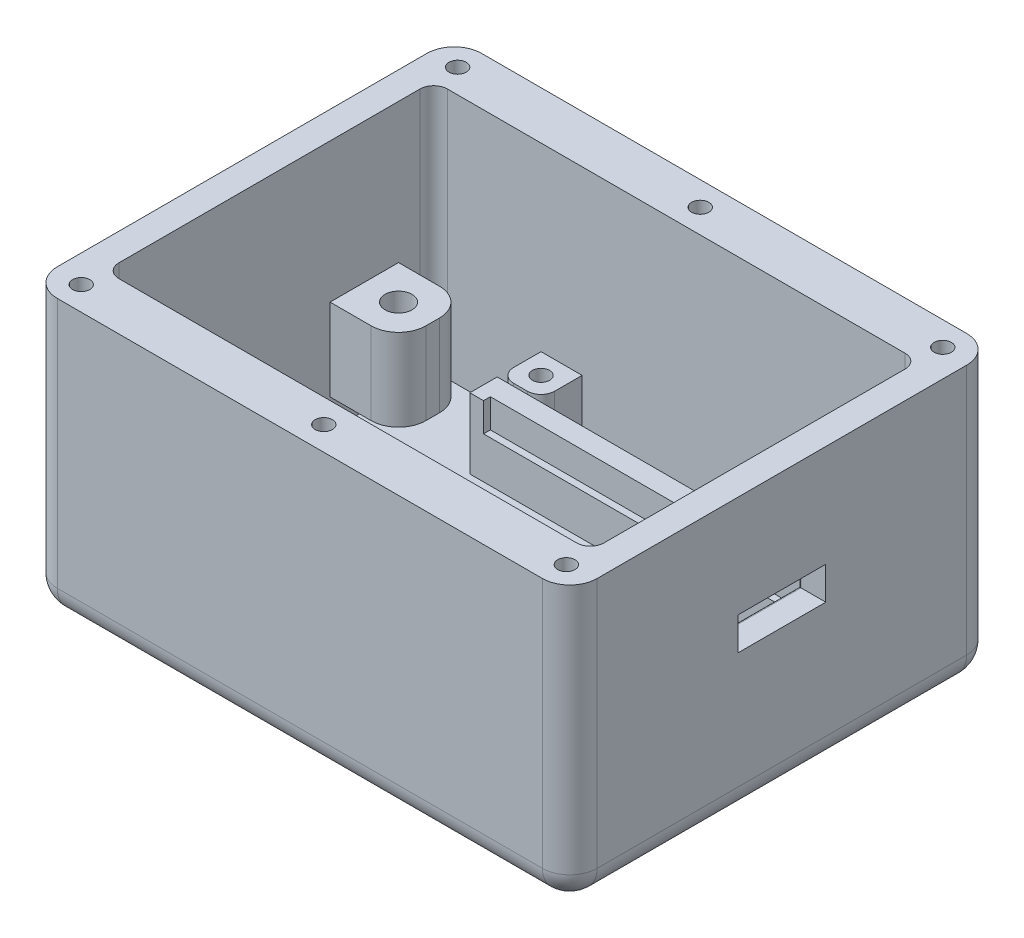
from build123d import *

# Parameters (mm, degrees)
SKETCH1_W                      = 50.0888
SKETCH1_H                      = 39.37
SKETCH1_W_2                    = 45.0088
SKETCH1_H_2                    = 30.48
BOSS_EXTRUDE1_DEPTH            = 23.2918
SKETCH2_W                      = 50.0888
SKETCH2_H                      = 39.37
BOSS_EXTRUDE2_DEPTH            = 2.54
SKETCH3_W                      = 32.512
SKETCH3_H                      = 2.54
BOSS_EXTRUDE3_DEPTH            = 6.5278
F_1_6_1_6_DIAMETER_HOLE1_D     = 1.6
F_1_6_1_6_DIAMETER_HOLE1_DEPTH = 5.08
FILLET1_R                      = 2.54
SKETCH12_W                     = 6.35
SKETCH12_H                     = 7.62
BOSS_EXTRUDE5_DEPTH            = 6.35
F_2_5_2_5_DIAMETER_HOLE2_D     = 2.5
F_2_5_2_5_DIAMETER_HOLE2_DEPTH = 7.62
FILLET2_R                      = 2.54
SKETCH17_W                     = 0.635
SKETCH17_H                     = 2.667
CUT_EXTRUDE3_DEPTH             = 31.242
SKETCH18_W                     = 0.635
SKETCH18_H                     = 2.667
CUT_EXTRUDE5_DEPTH             = 31.242
SKETCH15_W                     = 3.81
SKETCH15_H                     = 3.81
BOSS_EXTRUDE6_DEPTH            = 6.5278
FILLET3_R                      = 1.27
F_1_6_1_6_DIAMETER_HOLE2_D     = 1.6
F_1_6_1_6_DIAMETER_HOLE2_DEPTH = 5.08
CUT_EXTRUDE6_REACH             = 63.109
SKETCH23_W                     = 8.128
SKETCH23_H                     = 3.048
FILLET4_R                      = 0.254
FILLET5_R                      = 1.27


with BuildPart() as part:
    # Sketch1 → Boss-Extrude1 (new body)
    with BuildSketch(Plane(origin=(0, 0, 0), x_dir=(1, 0, 0), z_dir=(0, 1, 0))):
        with Locations((-15.50978333, -6.447590566)):
            Rectangle(SKETCH1_W, SKETCH1_H)
        with Locations((-15.50978333, -6.447590566)):
            Rectangle(SKETCH1_W_2, SKETCH1_H_2, mode=Mode.SUBTRACT)
    extrude(amount=BOSS_EXTRUDE1_DEPTH)

    # Sketch2 → Boss-Extrude2 (add)
    with BuildSketch(Plane.XZ):
        with Locations((-15.50978333, 6.447590566)):
            Rectangle(SKETCH2_W, SKETCH2_H)
    extrude(amount=BOSS_EXTRUDE2_DEPTH)

    # Sketch3 → Boss-Extrude3 (add)
    with BuildSketch(Plane(origin=(0, 0, 0), x_dir=(1, 0, 0), z_dir=(0, 1, 0))):
        with Locations((-11.80138333, 3.458409434)):
            Rectangle(SKETCH3_W, SKETCH3_H)
        with Locations((-11.80138333, -16.353590566)):
            Rectangle(SKETCH3_W, SKETCH3_H)
    extrude(amount=BOSS_EXTRUDE3_DEPTH)

    # Ø1.6 (1.6) Diameter Hole1
    with Locations(Plane(origin=(0, 23.2918, 0), x_dir=(1, 0, 0), z_dir=(0, 1, 0))):
        with Locations((-38.01418333, -23.910090566), (6.99461667, -23.910090566), (6.99461667, 11.014909434), (-38.01418333, 11.014909434), (-15.50978333, 11.014909434), (-15.50978333, -23.910090566)):
            Hole(F_1_6_1_6_DIAMETER_HOLE1_D / 2, depth=F_1_6_1_6_DIAMETER_HOLE1_DEPTH)

    # Fillet1
    fillet1_edges = [part.edges().sort_by_distance(p)[0] for p in [
        (-40.55418333, -2.54, 6.447590566),
        (-15.50978333, -2.54, -13.237409434),
        (9.53461667, -2.54, 6.447590566),
        (-15.50978333, -2.54, 26.132590566),
        (-40.55418333, 10.3759, -13.237409434),
        (9.53461667, 10.3759, -13.237409434),
        (9.53461667, 10.3759, 26.132590566),
        (-40.55418333, 10.3759, 26.132590566),
    ]]
    fillet(fillet1_edges, radius=FILLET1_R)

    # Sketch12 → Boss-Extrude5 (add)
    with BuildSketch(Plane(origin=(-38.01418333, 0, 0), x_dir=(0, 0, -1), z_dir=(1, 0, 0))):
        with Locations((-15.248690566, 6.5278)):
            Rectangle(SKETCH12_W, SKETCH12_H)
        with Locations((2.353509434, 6.5278)):
            Rectangle(SKETCH12_W, SKETCH12_H)
    extrude(amount=BOSS_EXTRUDE5_DEPTH)

    # Ø2.5 (2.5) Diameter Hole2
    with Locations(Plane(origin=(0, 10.3378, 0), x_dir=(1, 0, 0), z_dir=(0, 1, 0))):
        with Locations((-34.83918333, -15.248690566), (-34.83918333, 2.353509434)):
            Hole(F_2_5_2_5_DIAMETER_HOLE2_D / 2, depth=F_2_5_2_5_DIAMETER_HOLE2_DEPTH)

    # Fillet2
    fillet2_edges = [part.edges().sort_by_distance(p)[0] for p in [
        (-31.66418333, 6.5278, 18.423690566),
        (-31.66418333, 6.5278, 12.073690566),
        (-31.66418333, 6.5278, 0.821490566),
        (-31.66418333, 6.5278, -5.528509434),
    ]]
    fillet(fillet2_edges, radius=FILLET2_R)

    # Sketch17 → Cut-Extrude3 (cut)
    with BuildSketch(Plane(origin=(4.45461667, 0, 0), x_dir=(0, 0, -1), z_dir=(1, 0, 0))):
        with Locations((2.505909434, 5.1943)):
            Rectangle(SKETCH17_W, SKETCH17_H)
    extrude(amount=-CUT_EXTRUDE3_DEPTH, mode=Mode.SUBTRACT)

    # Sketch18 → Cut-Extrude5 (cut)
    with BuildSketch(Plane(origin=(4.45461667, 0, 0), x_dir=(0, 0, -1), z_dir=(1, 0, 0))):
        with Locations((-15.401090566, 5.1943)):
            Rectangle(SKETCH18_W, SKETCH18_H)
    extrude(amount=-CUT_EXTRUDE5_DEPTH, mode=Mode.SUBTRACT)

    # Sketch15 → Boss-Extrude6 (add)
    with BuildSketch(Plane(origin=(0, 0, 0), x_dir=(1, 0, 0), z_dir=(0, 1, 0))):
        with Locations((5.08961667, 6.887409434)):
            Rectangle(SKETCH15_W, SKETCH15_H)
        with Locations((-26.15238333, 6.887409434)):
            Rectangle(SKETCH15_W, SKETCH15_H)
        with Locations((-26.15238333, -19.782590566)):
            Rectangle(SKETCH15_W, SKETCH15_H)
        with Locations((5.08961667, -19.782590566)):
            Rectangle(SKETCH15_W, SKETCH15_H)
    extrude(amount=BOSS_EXTRUDE6_DEPTH)

    # Fillet3
    fillet3_edges = [part.edges().sort_by_distance(p)[0] for p in [
        (3.18461667, 3.2639, -4.982409434),
        (-28.05738333, 3.2639, -4.982409434),
        (-24.24738333, 3.2639, -4.982409434),
        (-28.05738333, 3.2639, 17.877590566),
        (-24.24738333, 3.2639, 17.877590566),
        (3.18461667, 3.2639, 17.877590566),
    ]]
    fillet(fillet3_edges, radius=FILLET3_R)

    # Ø1.6 (1.6) Diameter Hole2
    with Locations(Plane(origin=(0, 6.5278, 0), x_dir=(1, 0, 0), z_dir=(0, 1, 0))):
        with Locations((-26.15238333, -19.782590566), (-26.15238333, 6.887409434), (5.08961667, 6.887409434), (5.08961667, -19.782590566)):
            Hole(F_1_6_1_6_DIAMETER_HOLE2_D / 2, depth=F_1_6_1_6_DIAMETER_HOLE2_DEPTH)

    # Sketch23 → Cut-Extrude6 (cut, up to next)
    with BuildSketch(Plane(origin=(9.53461667, 0, 0), x_dir=(0, 0, -1), z_dir=(1, 0, 0)), mode=Mode.PRIVATE) as cut_extrude6_sk1:
        with Locations((-6.447590566, 12.3063)):
            Rectangle(SKETCH23_W, SKETCH23_H)
    cut_extrude6_tool1 = extrude(cut_extrude6_sk1.sketch, amount=-CUT_EXTRUDE6_REACH, mode=Mode.PRIVATE) & part.part
    add(cut_extrude6_tool1.solids().sort_by_distance((9.534617, 12.3063, 6.447591))[0], mode=Mode.SUBTRACT)

    # Fillet4
    fillet4_edges = [part.edges().sort_by_distance(p)[0] for p in [
        (6.99461667, 12.3063, 10.511590566),
        (6.99461667, 13.8303, 6.447590566),
        (6.99461667, 12.3063, 2.383590566),
        (6.99461667, 10.7823, 6.447590566),
    ]]
    fillet(fillet4_edges, radius=FILLET4_R)

    # Fillet5
    fillet5_edges = [part.edges().sort_by_distance(p)[0] for p in [
        (-38.01418333, 11.6459, -8.792409434),
        (-38.01418333, 11.6459, 21.687590566),
        (6.99461667, 14.9098, 21.687590566),
        (6.99461667, 14.9098, -8.792409434),
    ]]
    fillet(fillet5_edges, radius=FILLET5_R)


solid = part.part
